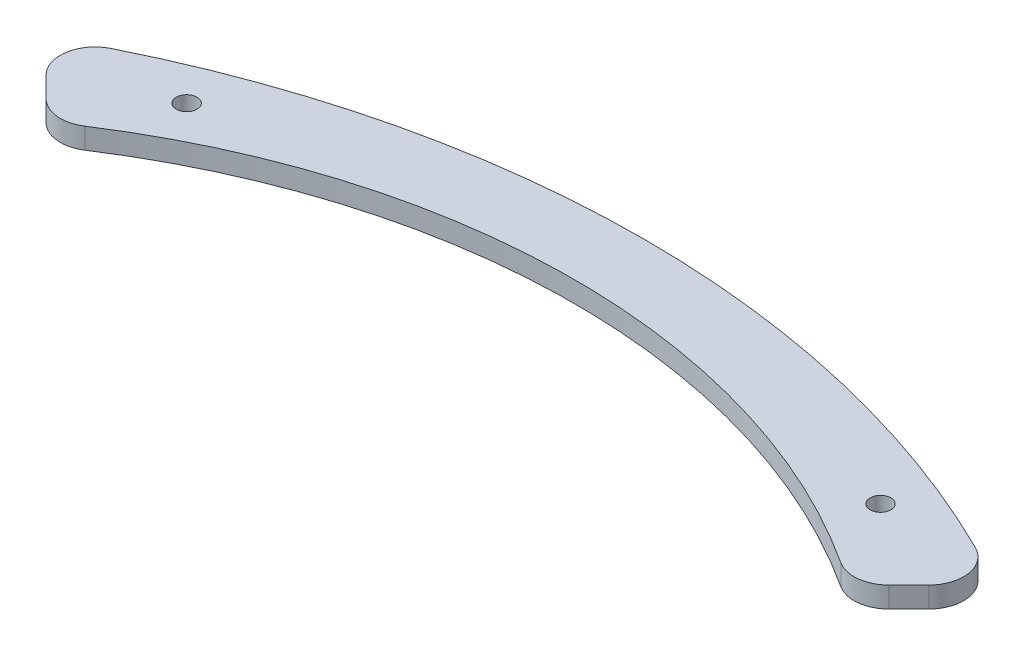
from build123d import *

# Parameters (mm, degrees)
BOSS_EXTRUDE1_DEPTH = 3
FILLET1_R           = 5
CUT_EXTRUDE1_REACH  = 156.417
SKETCH2_R           = 1.5


with BuildPart() as part:
    # Sketch1 → Boss-Extrude1 (new body)
    with BuildSketch(Plane(origin=(0, 0, 0), x_dir=(1, 0, 0), z_dir=(0, 1, 0))):
        with BuildLine():
            Line((-68.408481347, 122.148596717), (-57.801879629, 111.541994999))
            ThreePointArc((-57.801879629, 111.541994999), (0, 129.939649987), (57.801879629, 111.541994999))
            Line((57.801879629, 111.541994999), (68.408481347, 122.148596717))
            ThreePointArc((68.408481347, 122.148596717), (0, 140), (-68.408481347, 122.148596717))
        make_face()
    extrude(amount=BOSS_EXTRUDE1_DEPTH)

    # Fillet1
    fillet1_edges = [part.edges().sort_by_distance(p)[0] for p in [
        (68.408481347, 1.5, -122.148596717),
        (57.801879629, 1.5, -111.541994999),
        (-57.801879629, 1.5, -111.541994999),
        (-68.408481347, 1.5, -122.148596717),
    ]]
    fillet(fillet1_edges, radius=FILLET1_R)

    # Sketch2 → Cut-Extrude1 (cut, up to next)
    with BuildSketch(Plane(origin=(0, 3, 0), x_dir=(1, 0, 0), z_dir=(0, 1, 0)), mode=Mode.PRIVATE) as cut_extrude1_sk1:
        with Locations(Location((-50, 124, 0), (0, 0, 270))):
            Circle(SKETCH2_R)
    cut_extrude1_tool1 = extrude(cut_extrude1_sk1.sketch, amount=-CUT_EXTRUDE1_REACH, mode=Mode.PRIVATE) & part.part
    # Sketch2 → Cut-Extrude1 (cut, up to next)
    with BuildSketch(Plane(origin=(0, 3, 0), x_dir=(1, 0, 0), z_dir=(0, 1, 0)), mode=Mode.PRIVATE) as cut_extrude1_sk2:
        with Locations(Location((50, 124, 0), (0, 0, 270))):
            Circle(SKETCH2_R)
    cut_extrude1_tool2 = extrude(cut_extrude1_sk2.sketch, amount=-CUT_EXTRUDE1_REACH, mode=Mode.PRIVATE) & part.part
    add(cut_extrude1_tool1.solids().sort_by_distance((-50, 3, -124))[0], mode=Mode.SUBTRACT)
    add(cut_extrude1_tool2.solids().sort_by_distance((50, 3, -124))[0], mode=Mode.SUBTRACT)


solid = part.part
